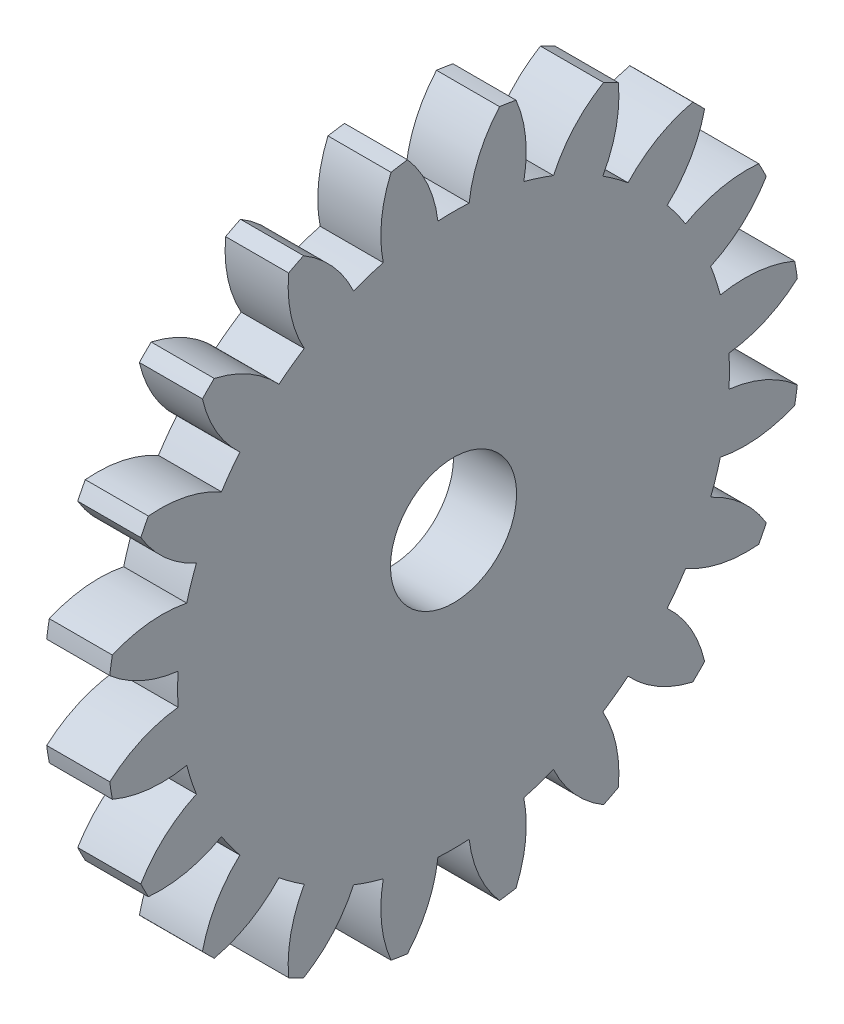
from build123d import *

# Parameters (mm, degrees)
BASPROSKE_W     = 5
BASPROSKE_H     = 27.5
TOOTHCUT_DEPTH  = 40.210967853
TEETHCUTS_COUNT = 20
TEETHCUTS_ANGLE = 342
BORSKE_R        = 5
BORE_DEPTH      = 50.0000508


with BuildPart() as part:
    # BasProSke → Base-Revolve (revolve)
    with BuildSketch(Plane(origin=(0, 0, 0), x_dir=(1, 0, 0), z_dir=(0, 1, 0)), mode=Mode.PRIVATE) as base_revolve_sk:
        with Locations((2.5, 13.75)):
            Rectangle(BASPROSKE_W, BASPROSKE_H)
    revolve(base_revolve_sk.sketch.rotate(Axis((-10, 0, 0), (1, 0, 0)), 180), axis=Axis((-10, 0, 0), (1, 0, 0)))

    # TooCutSke → ToothCut (cut, through all)
    with BuildSketch(Plane(origin=(0, 0, 0), x_dir=(0, 0, -1), z_dir=(1, 0, 0))):
        with BuildLine():
            ThreePointArc((1.237725267, 21.838954008), (0, 21.874), (-1.237725267, 21.838954008))
            ThreePointArc((-1.237725267, 21.838954008), (-2.037783758, 24.744650423), (-3.667234079, 27.280011719))
            ThreePointArc((-3.667234079, 27.280011719), (0, 27.5254), (3.667234079, 27.280011719))
            ThreePointArc((3.667234079, 27.280011719), (2.037783758, 24.744650423), (1.237725267, 21.838954008))
        make_face()
    toothcut = extrude(amount=TOOTHCUT_DEPTH, mode=Mode.SUBTRACT)

    # TeethCuts: ToothCut ×20 about axis
    teethcuts_axis = Axis((-10, 0, 0), (1, 0, 0))
    for i in range(1, TEETHCUTS_COUNT):
        add(toothcut.rotate(teethcuts_axis, i * TEETHCUTS_ANGLE / (TEETHCUTS_COUNT - 1)), mode=Mode.SUBTRACT)

    # BorSke → Bore (cut, symmetric)
    with BuildSketch(Plane(origin=(0, 0, 0), x_dir=(0, 0, -1), z_dir=(1, 0, 0))):
        with Locations(Location((0, 0, 0), (0, 0, 180))):
            Circle(BORSKE_R)
    extrude(amount=BORE_DEPTH, both=True, mode=Mode.SUBTRACT)


solid = part.part
